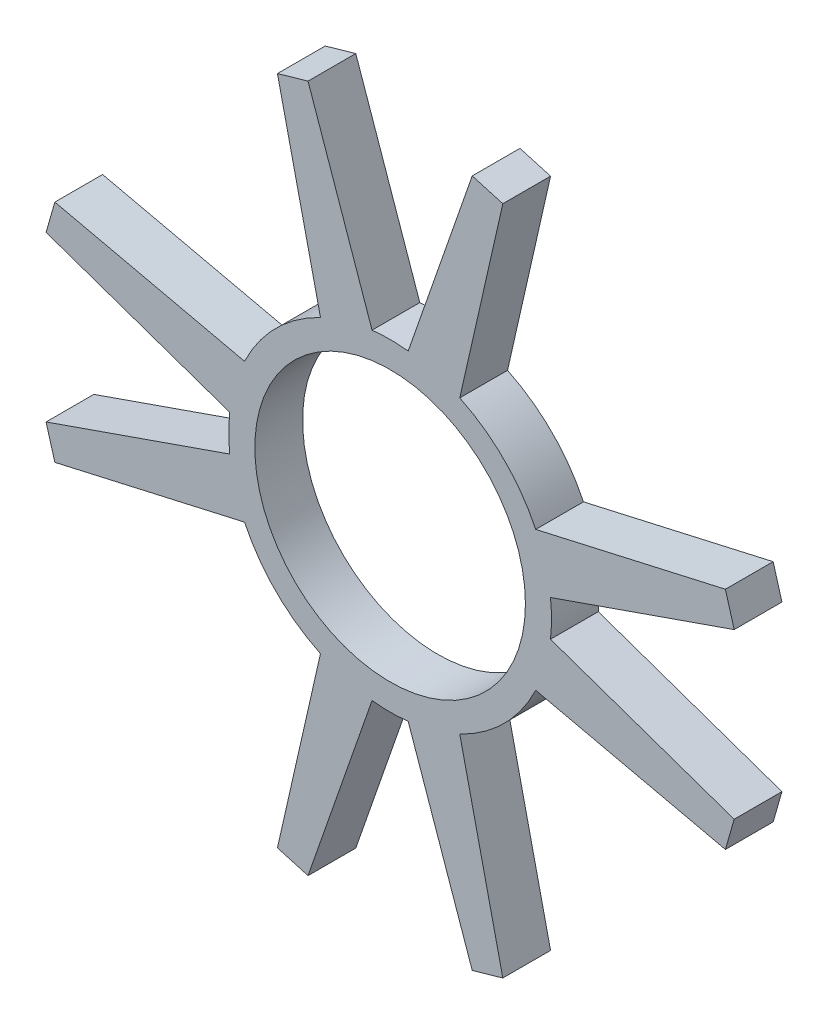
from build123d import *

# Parameters (mm, degrees)
SKETCH_1_R      = 8.5
EXTRUDE_1_DEPTH = 3


with BuildPart() as part:
    # 草图1 → 凸台-拉伸1 (new body)
    with BuildSketch(Plane.XY):
        with BuildLine():
            Line((21.064196615, 7.08036062), (9.146107852, 4.376016947))
            ThreePointArc((9.146107852, 4.376016947), (7.169407686, 7.169407686), (4.376016947, 9.146107852))
            Line((4.376016947, 9.146107852), (7.08036062, 21.064196615))
            Line((7.08036062, 21.064196615), (5.157837228, 21.615471327))
            Line((5.157837228, 21.615471327), (1.135625903, 10.075275031))
            ThreePointArc((1.135625903, 10.075275031), (0, 10.139073584), (-1.135625903, 10.075275031))
            Line((-1.135625903, 10.075275031), (-5.157837228, 21.615471327))
            Line((-5.157837228, 21.615471327), (-7.08036062, 21.064196615))
            Line((-7.08036062, 21.064196615), (-4.376016947, 9.146107852))
            ThreePointArc((-4.376016947, 9.146107852), (-7.169407686, 7.169407686), (-9.146107852, 4.376016947))
            Line((-9.146107852, 4.376016947), (-21.064196615, 7.08036062))
            Line((-21.064196615, 7.08036062), (-21.615471327, 5.157837228))
            Line((-21.615471327, 5.157837228), (-10.075275031, 1.135625903))
            ThreePointArc((-10.075275031, 1.135625903), (-10.139073584, 0), (-10.075275031, -1.135625903))
            Line((-10.075275031, -1.135625903), (-21.615471327, -5.157837228))
            Line((-21.615471327, -5.157837228), (-21.064196615, -7.08036062))
            Line((-21.064196615, -7.08036062), (-9.146107852, -4.376016947))
            ThreePointArc((-9.146107852, -4.376016947), (-7.169407686, -7.169407686), (-4.376016947, -9.146107852))
            Line((-4.376016947, -9.146107852), (-7.08036062, -21.064196615))
            Line((-7.08036062, -21.064196615), (-5.157837228, -21.615471327))
            Line((-5.157837228, -21.615471327), (-1.135625903, -10.075275031))
            ThreePointArc((-1.135625903, -10.075275031), (0, -10.139073584), (1.135625903, -10.075275031))
            Line((1.135625903, -10.075275031), (5.157837228, -21.615471327))
            Line((5.157837228, -21.615471327), (7.08036062, -21.064196615))
            Line((7.08036062, -21.064196615), (4.376016947, -9.146107852))
            ThreePointArc((4.376016947, -9.146107852), (7.169407686, -7.169407686), (9.146107852, -4.376016947))
            Line((9.146107852, -4.376016947), (21.064196615, -7.08036062))
            Line((21.064196615, -7.08036062), (21.615471327, -5.157837228))
            Line((21.615471327, -5.157837228), (10.075275031, -1.135625903))
            ThreePointArc((10.075275031, -1.135625903), (10.139073584, 0), (10.075275031, 1.135625903))
            Line((10.075275031, 1.135625903), (21.615471327, 5.157837228))
            Line((21.615471327, 5.157837228), (21.064196615, 7.08036062))
        make_face()
        Circle(SKETCH_1_R, mode=Mode.SUBTRACT)
    extrude(amount=EXTRUDE_1_DEPTH)


solid = part.part
